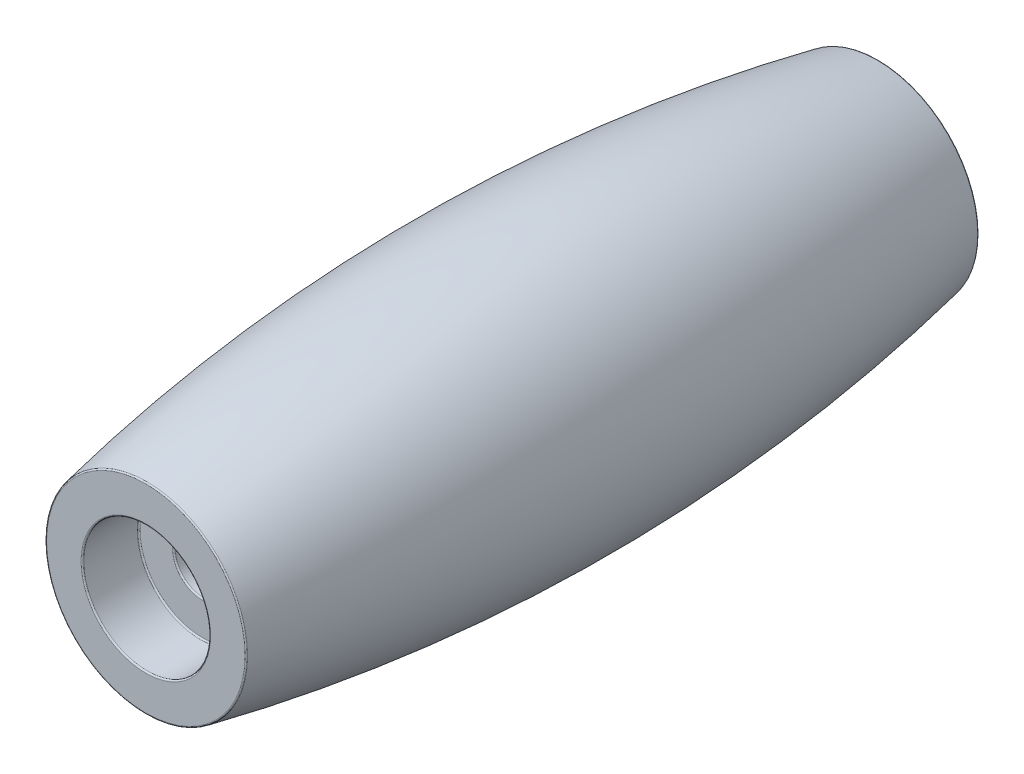
from build123d import *

# Parameters (mm, degrees)
FILLET1_R = 0.1


with BuildPart() as part:
    # Sketch1 → Revolve1 (revolve)
    with BuildSketch(Plane(origin=(0, 0, 0), x_dir=(1, 0, 0), z_dir=(0, 1, 0)), mode=Mode.PRIVATE) as revolve1_sk:
        with BuildLine():
            Line((2, 22), (2, -22))
            Line((2, -22), (4.5, -22))
            Line((4.5, -22), (4.5, -26))
            Line((4.5, -26), (7.125, -26))
            ThreePointArc((7.125, -26), (9.725, 0), (7.125, 26))
            Line((7.125, 26), (4.5, 26))
            Line((4.5, 26), (4.5, 22))
            Line((4.5, 22), (2, 22))
        make_face()
    revolve(revolve1_sk.sketch.rotate(Axis((0, 0, -26), (0, 0, 1)), 180), axis=Axis((0, 0, -26), (0, 0, 1)))

    # Fillet1
    fillet1_edges = [part.edges().sort_by_distance(p)[0] for p in [
        (4.5, 0, -22),
        (2, 0, -22),
        (2, 0, 22),
        (4.5, 0, 22),
        (4.5, 0, 26),
        (7.125, 0, 26),
        (7.125, 0, -26),
        (4.5, 0, -26),
    ]]
    fillet(fillet1_edges, radius=FILLET1_R)


solid = part.part
